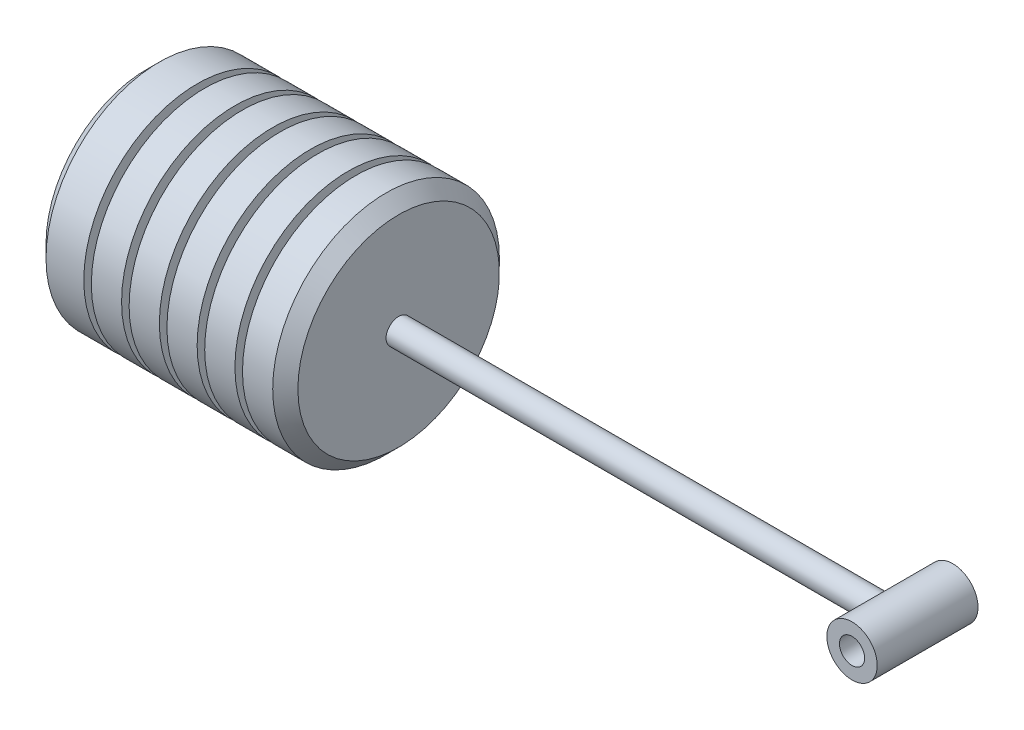
from build123d import *

# Parameters (mm, degrees)
SKETCH_2_R          = 5
EXTRUDE_1_DEPTH     = 200
SKETCH_3_R          = 10
EXTRUDE_2_DEPTH     = 20
SKETCH_4_R          = 5
CUT_EXTRUDE_1_DEPTH = 40


with BuildPart() as part:
    # Эскиз1 → Повернуть1 (revolve)
    with BuildSketch(Plane.XY, mode=Mode.PRIVATE) as revolve_1_sk:
        Polygon((0, 40), (5, 45), (20, 45), (20, 40), (23, 40), (23, 45), (35, 45), (35, 40), (38, 40), (38, 45), (50, 45), (50, 40), (53, 40), (53, 45), (65, 45), (65, 40), (68, 40), (68, 45), (80, 45), (80, 40), (83, 40), (83, 45), (95, 45), (100, 40), (100, 0), (0, 0), align=None)
    revolve(revolve_1_sk.sketch.rotate(Axis((-82.862068966, 0, 0), (1, 0, 0)), 90), axis=Axis((-82.862068966, 0, 0), (1, 0, 0)))

    # Эскиз2 → Бобышка-Вытянуть1 (add)
    with BuildSketch(Plane(origin=(100, 0, 0), x_dir=(0, 0, -1), z_dir=(1, 0, 0))):
        with Locations(Location((0, 0, 0), (0, 0, 180))):
            Circle(SKETCH_2_R)
    extrude(amount=EXTRUDE_1_DEPTH)

    # Эскиз3 → Бобышка-Вытянуть2 (add, symmetric)
    with BuildSketch(Plane.XY):
        with Locations((300, 0)):
            Circle(SKETCH_3_R)
    extrude(amount=EXTRUDE_2_DEPTH, both=True)

    # Эскиз4 → Вырез-Вытянуть1 (cut)
    with BuildSketch(Plane.XY.offset(20)):
        with Locations((300, 0)):
            Circle(SKETCH_4_R)
    extrude(amount=-CUT_EXTRUDE_1_DEPTH, mode=Mode.SUBTRACT)


solid = part.part
